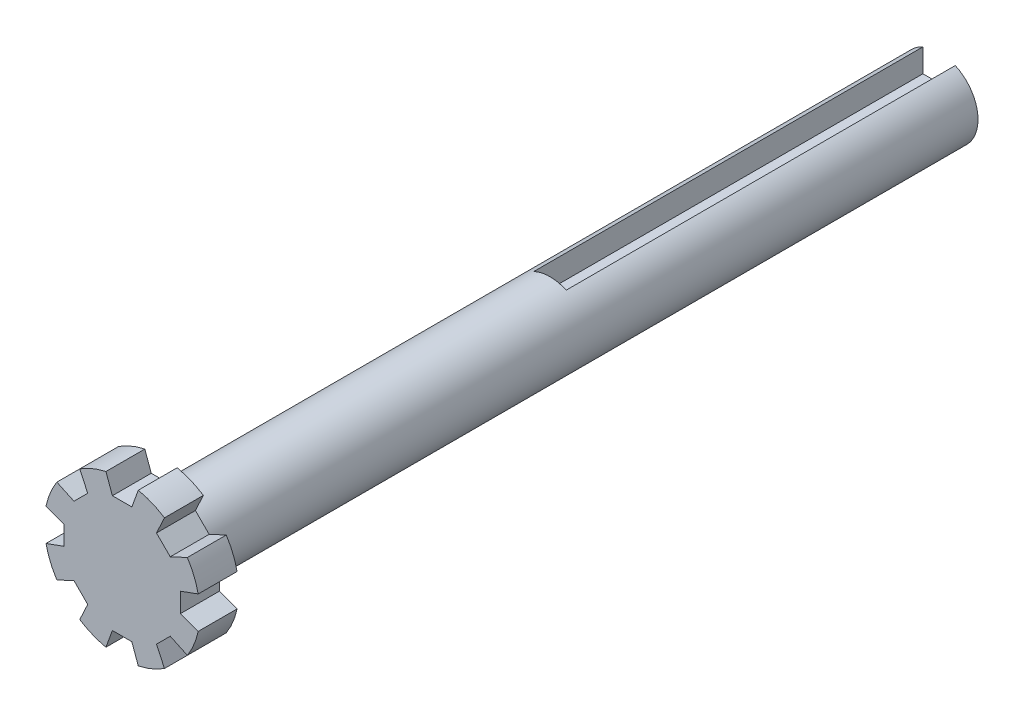
from build123d import *

# Parameters (mm, degrees)
SKETCH1_R              = 1
BASE_DEPTH             = 0.5
CUT_EXTRUDE6_DEPTH     = 2.5
CIRPATTERN1_COUNT      = 8
WHOLE_CONNECTION_DEPTH = 10
SKETCH1_6_R            = 0.5
ON_BEARING_DEPTH       = 5


with BuildPart() as part:
    # Sketch1 → Base (new body)
    with BuildSketch(Plane.XY):
        Circle(SKETCH1_R)
    extrude(amount=BASE_DEPTH)

    # Sketch1<3> → Cut-Extrude6 (cut, symmetric)
    with BuildSketch(Plane.XY):
        with BuildLine():
            Line((0.125, 0.75), (0.208029796, 0.978122489))
            ThreePointArc((0.208029796, 0.978122489), (0, 1), (-0.208029796, 0.978122489))
            Line((-0.208029796, 0.978122489), (-0.125, 0.75))
            Line((-0.125, 0.75), (0, 0.75))
            Line((0, 0.75), (0.125, 0.75))
        make_face()
    cut_extrude6 = extrude(amount=CUT_EXTRUDE6_DEPTH, both=True, mode=Mode.SUBTRACT)

    # CirPattern1: Cut-Extrude6 ×8 about axis
    cirpattern1_axis = Axis((0, 0, 0.5), (0, 0, -1))
    for i in range(1, CIRPATTERN1_COUNT):
        add(cut_extrude6.rotate(cirpattern1_axis, i * 360 / CIRPATTERN1_COUNT), mode=Mode.SUBTRACT)

    # Sketch1<5> → Whole-connection (add)
    with BuildSketch(Plane.XY):
        with BuildLine():
            Line((0.208029796, 0.454668675), (0.208029796, 0.154668675))
            Line((0.208029796, 0.154668675), (-0.208029796, 0.154668675))
            Line((-0.208029796, 0.154668675), (-0.208029796, 0.454668675))
            ThreePointArc((-0.208029796, 0.454668675), (0, -0.5), (0.208029796, 0.454668675))
        make_face()
    extrude(amount=-WHOLE_CONNECTION_DEPTH)

    # Sketch1<6> → On-bearing (add)
    with BuildSketch(Plane.XY):
        Circle(SKETCH1_6_R)
    extrude(amount=-ON_BEARING_DEPTH)


solid = part.part
